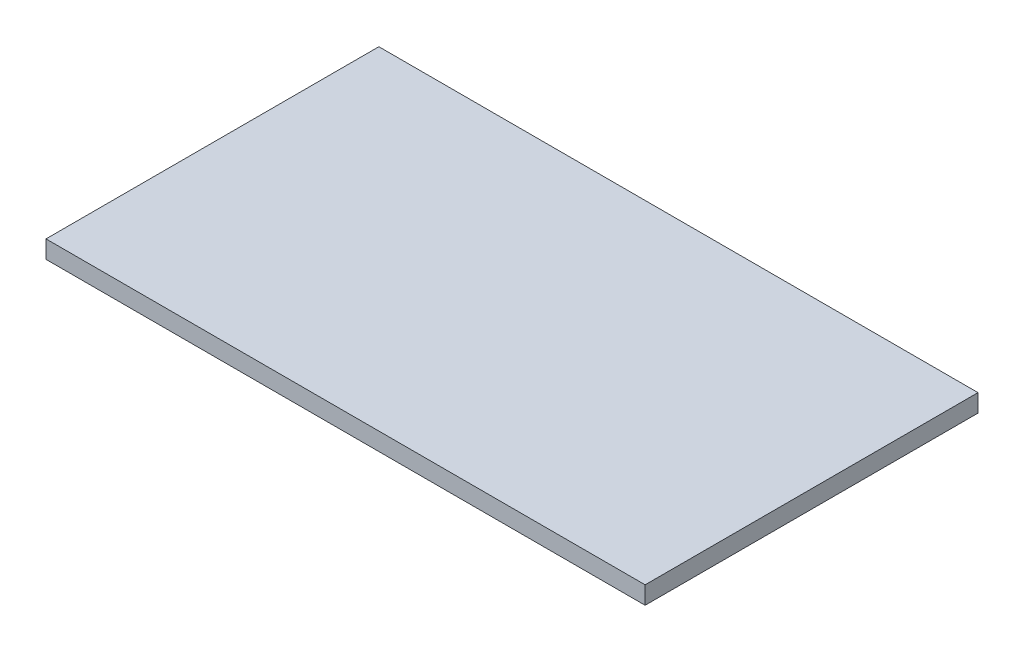
from build123d import *

# Parameters (mm, degrees)
SKETCH_1_W      = 270
SKETCH_1_H      = 150
EXTRUDE_1_DEPTH = 8


with BuildPart() as part:
    # Эскиз1 → Бобышка-Вытянуть1 (new body)
    with BuildSketch(Plane(origin=(0, 0, 0), x_dir=(1, 0, 0), z_dir=(0, 1, 0))):
        Rectangle(SKETCH_1_W, SKETCH_1_H)
    extrude(amount=EXTRUDE_1_DEPTH)


solid = part.part
